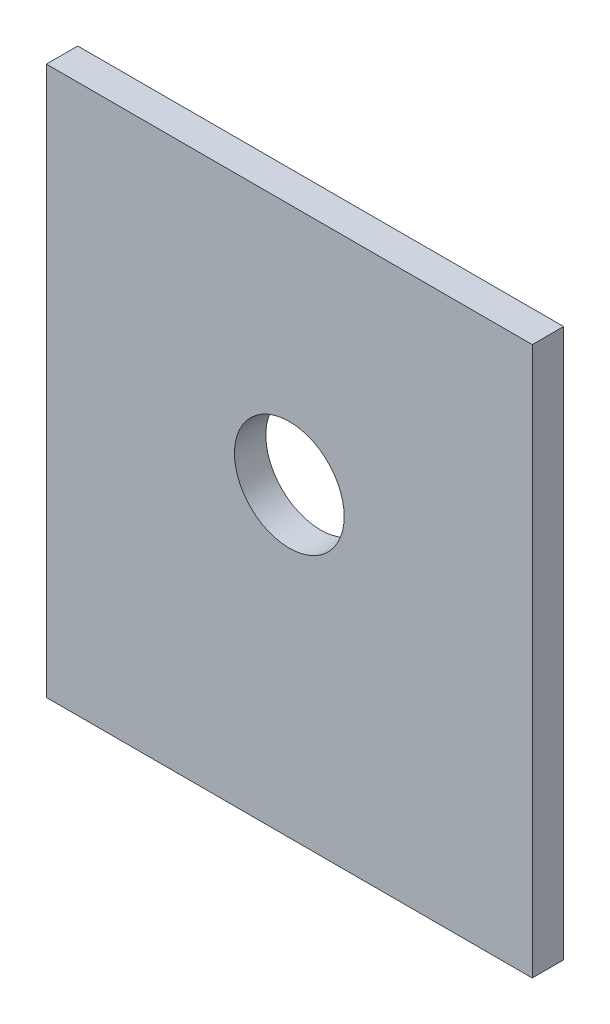
from build123d import *

# Parameters (mm, degrees)
SKETCH1_W           = 62
SKETCH1_H           = 70
SKETCH1_R           = 7
BOSS_EXTRUDE1_DEPTH = 4


with BuildPart() as part:
    # Sketch1 → Boss-Extrude1 (new body)
    with BuildSketch(Plane.XY):
        with Locations((21, 17)):
            Rectangle(SKETCH1_W, SKETCH1_H)
        with Locations((21, 21)):
            Circle(SKETCH1_R, mode=Mode.SUBTRACT)
    extrude(amount=BOSS_EXTRUDE1_DEPTH)


solid = part.part
